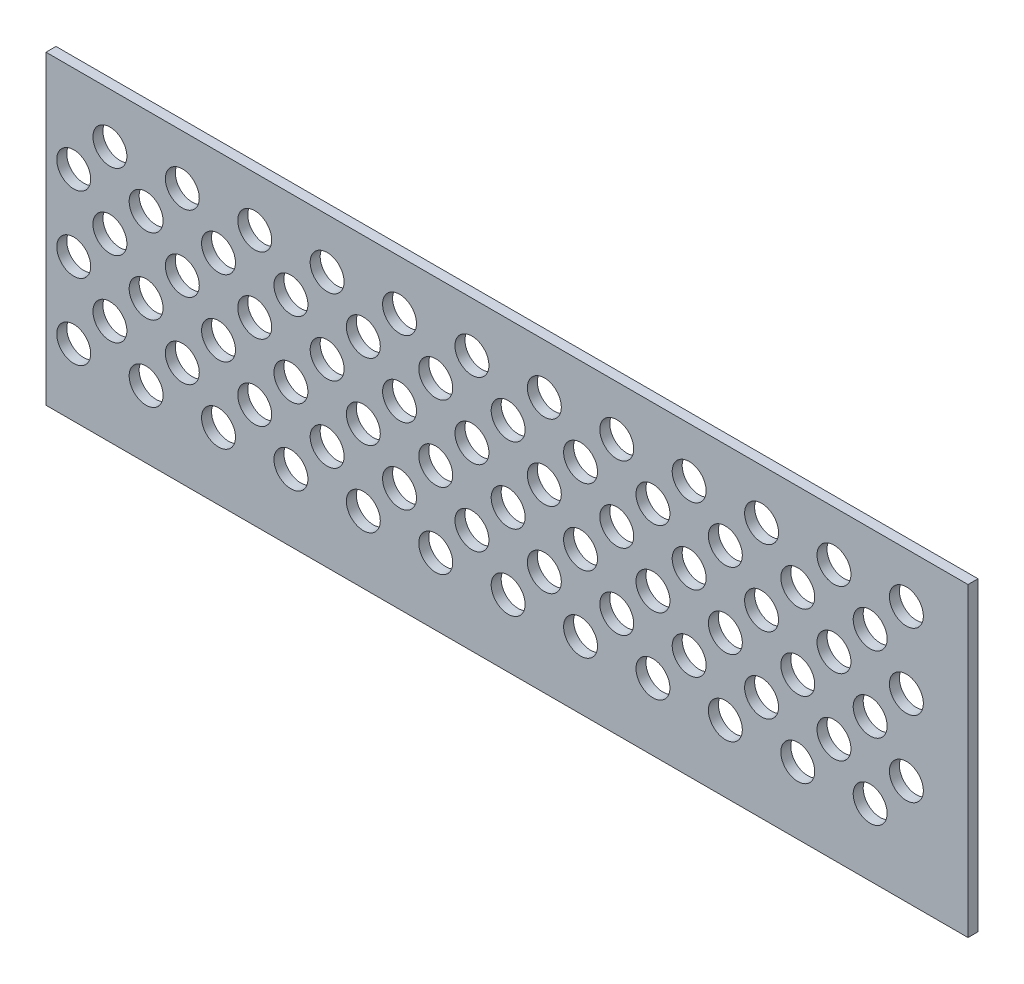
from build123d import *

# Parameters (mm, degrees)
SKETCH1_W                  = 585.750000132
SKETCH1_H                  = 194.250000104
BOSS_EXTRUDE1_DEPTH        = 6.35
SKETCH3_R                  = 10.775
CUT_EXTRUDE1_DEPTH         = 311.391443479
SKETCH4_R                  = 10.775
CUT_EXTRUDE2_DEPTH         = 311.391443479
LPATTERN1_COUNT            = 12
LPATTERN1_PITCH            = 46
LPATTERN2_COUNT            = 3
LPATTERN2_PITCH            = 48
LPATTERN2_COPY_1_SKETCH_R  = 10.775
LPATTERN2_COPY_1_DEPTH     = 311.391443479
LPATTERN2_COPY_2_SKETCH_R  = 10.775
LPATTERN2_COPY_2_DEPTH     = 311.391443479
LPATTERN2_COPY_3_SKETCH_R  = 10.775
LPATTERN2_COPY_3_DEPTH     = 311.391443479
LPATTERN2_COPY_4_SKETCH_R  = 10.775
LPATTERN2_COPY_4_DEPTH     = 311.391443479
LPATTERN2_COPY_5_SKETCH_R  = 10.775
LPATTERN2_COPY_5_DEPTH     = 311.391443479
LPATTERN2_COPY_6_SKETCH_R  = 10.775
LPATTERN2_COPY_6_DEPTH     = 311.391443479
LPATTERN2_COPY_7_SKETCH_R  = 10.775
LPATTERN2_COPY_7_DEPTH     = 311.391443479
LPATTERN2_COPY_8_SKETCH_R  = 10.775
LPATTERN2_COPY_8_DEPTH     = 311.391443479
LPATTERN2_COPY_9_SKETCH_R  = 10.775
LPATTERN2_COPY_9_DEPTH     = 311.391443479
LPATTERN2_COPY_10_SKETCH_R = 10.775
LPATTERN2_COPY_10_DEPTH    = 311.391443479
LPATTERN2_COPY_11_SKETCH_R = 10.775
LPATTERN2_COPY_11_DEPTH    = 311.391443479
LPATTERN2_COPY_12_SKETCH_R = 10.775
LPATTERN2_COPY_12_DEPTH    = 311.391443479
LPATTERN2_COPY_13_SKETCH_R = 10.775
LPATTERN2_COPY_13_DEPTH    = 311.391443479
LPATTERN2_COPY_14_SKETCH_R = 10.775
LPATTERN2_COPY_14_DEPTH    = 311.391443479
LPATTERN2_COPY_15_SKETCH_R = 10.775
LPATTERN2_COPY_15_DEPTH    = 311.391443479
LPATTERN2_COPY_16_SKETCH_R = 10.775
LPATTERN2_COPY_16_DEPTH    = 311.391443479
LPATTERN2_COPY_17_SKETCH_R = 10.775
LPATTERN2_COPY_17_DEPTH    = 311.391443479
LPATTERN2_COPY_18_SKETCH_R = 10.775
LPATTERN2_COPY_18_DEPTH    = 311.391443479
LPATTERN2_COPY_19_SKETCH_R = 10.775
LPATTERN2_COPY_19_DEPTH    = 311.391443479
LPATTERN2_COPY_20_SKETCH_R = 10.775
LPATTERN2_COPY_20_DEPTH    = 311.391443479
LPATTERN2_COPY_21_SKETCH_R = 10.775
LPATTERN2_COPY_21_DEPTH    = 311.391443479
LPATTERN2_COPY_22_SKETCH_R = 10.775
LPATTERN2_COPY_22_DEPTH    = 311.391443479
LPATTERN2_COPY_23_SKETCH_R = 10.775
LPATTERN2_COPY_23_DEPTH    = 311.391443479
LPATTERN2_COPY_24_SKETCH_R = 10.775
LPATTERN2_COPY_24_DEPTH    = 311.391443479
LPATTERN2_COPY_25_SKETCH_R = 10.775
LPATTERN2_COPY_25_DEPTH    = 311.391443479
LPATTERN2_COPY_26_SKETCH_R = 10.775
LPATTERN2_COPY_26_DEPTH    = 311.391443479
LPATTERN2_COPY_27_SKETCH_R = 10.775
LPATTERN2_COPY_27_DEPTH    = 311.391443479
LPATTERN2_COPY_28_SKETCH_R = 10.775
LPATTERN2_COPY_28_DEPTH    = 311.391443479
LPATTERN2_COPY_29_SKETCH_R = 10.775
LPATTERN2_COPY_29_DEPTH    = 311.391443479
LPATTERN2_COPY_30_SKETCH_R = 10.775
LPATTERN2_COPY_30_DEPTH    = 311.391443479
LPATTERN2_COPY_31_SKETCH_R = 10.775
LPATTERN2_COPY_31_DEPTH    = 311.391443479
LPATTERN2_COPY_32_SKETCH_R = 10.775
LPATTERN2_COPY_32_DEPTH    = 311.391443479
LPATTERN2_COPY_33_SKETCH_R = 10.775
LPATTERN2_COPY_33_DEPTH    = 311.391443479
LPATTERN2_COPY_34_SKETCH_R = 10.775
LPATTERN2_COPY_34_DEPTH    = 311.391443479
LPATTERN2_COPY_35_SKETCH_R = 10.775
LPATTERN2_COPY_35_DEPTH    = 311.391443479
LPATTERN2_COPY_36_SKETCH_R = 10.775
LPATTERN2_COPY_36_DEPTH    = 311.391443479
LPATTERN2_COPY_37_SKETCH_R = 10.775
LPATTERN2_COPY_37_DEPTH    = 311.391443479
LPATTERN2_COPY_38_SKETCH_R = 10.775
LPATTERN2_COPY_38_DEPTH    = 311.391443479
LPATTERN2_COPY_39_SKETCH_R = 10.775
LPATTERN2_COPY_39_DEPTH    = 311.391443479
LPATTERN2_COPY_40_SKETCH_R = 10.775
LPATTERN2_COPY_40_DEPTH    = 311.391443479
LPATTERN2_COPY_41_SKETCH_R = 10.775
LPATTERN2_COPY_41_DEPTH    = 311.391443479
LPATTERN2_COPY_42_SKETCH_R = 10.775
LPATTERN2_COPY_42_DEPTH    = 311.391443479
LPATTERN2_COPY_43_SKETCH_R = 10.775
LPATTERN2_COPY_43_DEPTH    = 311.391443479
LPATTERN2_COPY_44_SKETCH_R = 10.775
LPATTERN2_COPY_44_DEPTH    = 311.391443479


with BuildPart() as part:
    # Sketch1 → Boss-Extrude1 (new body)
    with BuildSketch(Plane.XY):
        with Locations((0, -5.475000052)):
            Rectangle(SKETCH1_W, SKETCH1_H)
    extrude(amount=BOSS_EXTRUDE1_DEPTH)

    # Sketch3 → Cut-Extrude1 (cut, through all)
    with BuildSketch(Plane.XY.offset(6.35)):
        with Locations((-275.275, -60)):
            Circle(SKETCH3_R)
    cut_extrude1 = extrude(amount=-CUT_EXTRUDE1_DEPTH, mode=Mode.SUBTRACT)

    # Sketch4 → Cut-Extrude2 (cut, through all)
    with BuildSketch(Plane.XY.offset(6.35)):
        with Locations((-252.275, -36)):
            Circle(SKETCH4_R)
    cut_extrude2 = extrude(amount=-CUT_EXTRUDE2_DEPTH, mode=Mode.SUBTRACT)

    # LPattern1: Cut-Extrude1, Cut-Extrude2 ×12
    with Locations(*[(i * LPATTERN1_PITCH, 0, 0) for i in range(1, LPATTERN1_COUNT)]):
        add(cut_extrude1, mode=Mode.SUBTRACT)
        add(cut_extrude2, mode=Mode.SUBTRACT)

    # LPattern2: Cut-Extrude1, Cut-Extrude2 ×3
    with Locations(*[(0, i * LPATTERN2_PITCH, 0) for i in range(1, LPATTERN2_COUNT)]):
        add(cut_extrude1, mode=Mode.SUBTRACT)
        add(cut_extrude2, mode=Mode.SUBTRACT)

    # LPattern2 copy 1 sketch → LPattern2 copy 1 (cut, through all)
    with BuildSketch(Plane(origin=(46, 48, 6.35), x_dir=(1, 0, 0), z_dir=(0, 0, 1))):
        with Locations((-275.275, -60)):
            Circle(LPATTERN2_COPY_1_SKETCH_R)
    extrude(amount=-LPATTERN2_COPY_1_DEPTH, mode=Mode.SUBTRACT)

    # LPattern2 copy 2 sketch → LPattern2 copy 2 (cut, through all)
    with BuildSketch(Plane(origin=(46, 96, 6.35), x_dir=(1, 0, 0), z_dir=(0, 0, 1))):
        with Locations((-275.275, -60)):
            Circle(LPATTERN2_COPY_2_SKETCH_R)
    extrude(amount=-LPATTERN2_COPY_2_DEPTH, mode=Mode.SUBTRACT)

    # LPattern2 copy 3 sketch → LPattern2 copy 3 (cut, through all)
    with BuildSketch(Plane(origin=(92, 48, 6.35), x_dir=(1, 0, 0), z_dir=(0, 0, 1))):
        with Locations((-275.275, -60)):
            Circle(LPATTERN2_COPY_3_SKETCH_R)
    extrude(amount=-LPATTERN2_COPY_3_DEPTH, mode=Mode.SUBTRACT)

    # LPattern2 copy 4 sketch → LPattern2 copy 4 (cut, through all)
    with BuildSketch(Plane(origin=(92, 96, 6.35), x_dir=(1, 0, 0), z_dir=(0, 0, 1))):
        with Locations((-275.275, -60)):
            Circle(LPATTERN2_COPY_4_SKETCH_R)
    extrude(amount=-LPATTERN2_COPY_4_DEPTH, mode=Mode.SUBTRACT)

    # LPattern2 copy 5 sketch → LPattern2 copy 5 (cut, through all)
    with BuildSketch(Plane(origin=(138, 48, 6.35), x_dir=(1, 0, 0), z_dir=(0, 0, 1))):
        with Locations((-275.275, -60)):
            Circle(LPATTERN2_COPY_5_SKETCH_R)
    extrude(amount=-LPATTERN2_COPY_5_DEPTH, mode=Mode.SUBTRACT)

    # LPattern2 copy 6 sketch → LPattern2 copy 6 (cut, through all)
    with BuildSketch(Plane(origin=(138, 96, 6.35), x_dir=(1, 0, 0), z_dir=(0, 0, 1))):
        with Locations((-275.275, -60)):
            Circle(LPATTERN2_COPY_6_SKETCH_R)
    extrude(amount=-LPATTERN2_COPY_6_DEPTH, mode=Mode.SUBTRACT)

    # LPattern2 copy 7 sketch → LPattern2 copy 7 (cut, through all)
    with BuildSketch(Plane(origin=(184, 48, 6.35), x_dir=(1, 0, 0), z_dir=(0, 0, 1))):
        with Locations((-275.275, -60)):
            Circle(LPATTERN2_COPY_7_SKETCH_R)
    extrude(amount=-LPATTERN2_COPY_7_DEPTH, mode=Mode.SUBTRACT)

    # LPattern2 copy 8 sketch → LPattern2 copy 8 (cut, through all)
    with BuildSketch(Plane(origin=(184, 96, 6.35), x_dir=(1, 0, 0), z_dir=(0, 0, 1))):
        with Locations((-275.275, -60)):
            Circle(LPATTERN2_COPY_8_SKETCH_R)
    extrude(amount=-LPATTERN2_COPY_8_DEPTH, mode=Mode.SUBTRACT)

    # LPattern2 copy 9 sketch → LPattern2 copy 9 (cut, through all)
    with BuildSketch(Plane(origin=(230, 48, 6.35), x_dir=(1, 0, 0), z_dir=(0, 0, 1))):
        with Locations((-275.275, -60)):
            Circle(LPATTERN2_COPY_9_SKETCH_R)
    extrude(amount=-LPATTERN2_COPY_9_DEPTH, mode=Mode.SUBTRACT)

    # LPattern2 copy 10 sketch → LPattern2 copy 10 (cut, through all)
    with BuildSketch(Plane(origin=(230, 96, 6.35), x_dir=(1, 0, 0), z_dir=(0, 0, 1))):
        with Locations((-275.275, -60)):
            Circle(LPATTERN2_COPY_10_SKETCH_R)
    extrude(amount=-LPATTERN2_COPY_10_DEPTH, mode=Mode.SUBTRACT)

    # LPattern2 copy 11 sketch → LPattern2 copy 11 (cut, through all)
    with BuildSketch(Plane(origin=(276, 48, 6.35), x_dir=(1, 0, 0), z_dir=(0, 0, 1))):
        with Locations((-275.275, -60)):
            Circle(LPATTERN2_COPY_11_SKETCH_R)
    extrude(amount=-LPATTERN2_COPY_11_DEPTH, mode=Mode.SUBTRACT)

    # LPattern2 copy 12 sketch → LPattern2 copy 12 (cut, through all)
    with BuildSketch(Plane(origin=(276, 96, 6.35), x_dir=(1, 0, 0), z_dir=(0, 0, 1))):
        with Locations((-275.275, -60)):
            Circle(LPATTERN2_COPY_12_SKETCH_R)
    extrude(amount=-LPATTERN2_COPY_12_DEPTH, mode=Mode.SUBTRACT)

    # LPattern2 copy 13 sketch → LPattern2 copy 13 (cut, through all)
    with BuildSketch(Plane(origin=(322, 48, 6.35), x_dir=(1, 0, 0), z_dir=(0, 0, 1))):
        with Locations((-275.275, -60)):
            Circle(LPATTERN2_COPY_13_SKETCH_R)
    extrude(amount=-LPATTERN2_COPY_13_DEPTH, mode=Mode.SUBTRACT)

    # LPattern2 copy 14 sketch → LPattern2 copy 14 (cut, through all)
    with BuildSketch(Plane(origin=(322, 96, 6.35), x_dir=(1, 0, 0), z_dir=(0, 0, 1))):
        with Locations((-275.275, -60)):
            Circle(LPATTERN2_COPY_14_SKETCH_R)
    extrude(amount=-LPATTERN2_COPY_14_DEPTH, mode=Mode.SUBTRACT)

    # LPattern2 copy 15 sketch → LPattern2 copy 15 (cut, through all)
    with BuildSketch(Plane(origin=(368, 48, 6.35), x_dir=(1, 0, 0), z_dir=(0, 0, 1))):
        with Locations((-275.275, -60)):
            Circle(LPATTERN2_COPY_15_SKETCH_R)
    extrude(amount=-LPATTERN2_COPY_15_DEPTH, mode=Mode.SUBTRACT)

    # LPattern2 copy 16 sketch → LPattern2 copy 16 (cut, through all)
    with BuildSketch(Plane(origin=(368, 96, 6.35), x_dir=(1, 0, 0), z_dir=(0, 0, 1))):
        with Locations((-275.275, -60)):
            Circle(LPATTERN2_COPY_16_SKETCH_R)
    extrude(amount=-LPATTERN2_COPY_16_DEPTH, mode=Mode.SUBTRACT)

    # LPattern2 copy 17 sketch → LPattern2 copy 17 (cut, through all)
    with BuildSketch(Plane(origin=(414, 48, 6.35), x_dir=(1, 0, 0), z_dir=(0, 0, 1))):
        with Locations((-275.275, -60)):
            Circle(LPATTERN2_COPY_17_SKETCH_R)
    extrude(amount=-LPATTERN2_COPY_17_DEPTH, mode=Mode.SUBTRACT)

    # LPattern2 copy 18 sketch → LPattern2 copy 18 (cut, through all)
    with BuildSketch(Plane(origin=(414, 96, 6.35), x_dir=(1, 0, 0), z_dir=(0, 0, 1))):
        with Locations((-275.275, -60)):
            Circle(LPATTERN2_COPY_18_SKETCH_R)
    extrude(amount=-LPATTERN2_COPY_18_DEPTH, mode=Mode.SUBTRACT)

    # LPattern2 copy 19 sketch → LPattern2 copy 19 (cut, through all)
    with BuildSketch(Plane(origin=(460, 48, 6.35), x_dir=(1, 0, 0), z_dir=(0, 0, 1))):
        with Locations((-275.275, -60)):
            Circle(LPATTERN2_COPY_19_SKETCH_R)
    extrude(amount=-LPATTERN2_COPY_19_DEPTH, mode=Mode.SUBTRACT)

    # LPattern2 copy 20 sketch → LPattern2 copy 20 (cut, through all)
    with BuildSketch(Plane(origin=(460, 96, 6.35), x_dir=(1, 0, 0), z_dir=(0, 0, 1))):
        with Locations((-275.275, -60)):
            Circle(LPATTERN2_COPY_20_SKETCH_R)
    extrude(amount=-LPATTERN2_COPY_20_DEPTH, mode=Mode.SUBTRACT)

    # LPattern2 copy 21 sketch → LPattern2 copy 21 (cut, through all)
    with BuildSketch(Plane(origin=(506, 48, 6.35), x_dir=(1, 0, 0), z_dir=(0, 0, 1))):
        with Locations((-275.275, -60)):
            Circle(LPATTERN2_COPY_21_SKETCH_R)
    extrude(amount=-LPATTERN2_COPY_21_DEPTH, mode=Mode.SUBTRACT)

    # LPattern2 copy 22 sketch → LPattern2 copy 22 (cut, through all)
    with BuildSketch(Plane(origin=(506, 96, 6.35), x_dir=(1, 0, 0), z_dir=(0, 0, 1))):
        with Locations((-275.275, -60)):
            Circle(LPATTERN2_COPY_22_SKETCH_R)
    extrude(amount=-LPATTERN2_COPY_22_DEPTH, mode=Mode.SUBTRACT)

    # LPattern2 copy 23 sketch → LPattern2 copy 23 (cut, through all)
    with BuildSketch(Plane(origin=(46, 48, 6.35), x_dir=(1, 0, 0), z_dir=(0, 0, 1))):
        with Locations((-252.275, -36)):
            Circle(LPATTERN2_COPY_23_SKETCH_R)
    extrude(amount=-LPATTERN2_COPY_23_DEPTH, mode=Mode.SUBTRACT)

    # LPattern2 copy 24 sketch → LPattern2 copy 24 (cut, through all)
    with BuildSketch(Plane(origin=(46, 96, 6.35), x_dir=(1, 0, 0), z_dir=(0, 0, 1))):
        with Locations((-252.275, -36)):
            Circle(LPATTERN2_COPY_24_SKETCH_R)
    extrude(amount=-LPATTERN2_COPY_24_DEPTH, mode=Mode.SUBTRACT)

    # LPattern2 copy 25 sketch → LPattern2 copy 25 (cut, through all)
    with BuildSketch(Plane(origin=(92, 48, 6.35), x_dir=(1, 0, 0), z_dir=(0, 0, 1))):
        with Locations((-252.275, -36)):
            Circle(LPATTERN2_COPY_25_SKETCH_R)
    extrude(amount=-LPATTERN2_COPY_25_DEPTH, mode=Mode.SUBTRACT)

    # LPattern2 copy 26 sketch → LPattern2 copy 26 (cut, through all)
    with BuildSketch(Plane(origin=(92, 96, 6.35), x_dir=(1, 0, 0), z_dir=(0, 0, 1))):
        with Locations((-252.275, -36)):
            Circle(LPATTERN2_COPY_26_SKETCH_R)
    extrude(amount=-LPATTERN2_COPY_26_DEPTH, mode=Mode.SUBTRACT)

    # LPattern2 copy 27 sketch → LPattern2 copy 27 (cut, through all)
    with BuildSketch(Plane(origin=(138, 48, 6.35), x_dir=(1, 0, 0), z_dir=(0, 0, 1))):
        with Locations((-252.275, -36)):
            Circle(LPATTERN2_COPY_27_SKETCH_R)
    extrude(amount=-LPATTERN2_COPY_27_DEPTH, mode=Mode.SUBTRACT)

    # LPattern2 copy 28 sketch → LPattern2 copy 28 (cut, through all)
    with BuildSketch(Plane(origin=(138, 96, 6.35), x_dir=(1, 0, 0), z_dir=(0, 0, 1))):
        with Locations((-252.275, -36)):
            Circle(LPATTERN2_COPY_28_SKETCH_R)
    extrude(amount=-LPATTERN2_COPY_28_DEPTH, mode=Mode.SUBTRACT)

    # LPattern2 copy 29 sketch → LPattern2 copy 29 (cut, through all)
    with BuildSketch(Plane(origin=(184, 48, 6.35), x_dir=(1, 0, 0), z_dir=(0, 0, 1))):
        with Locations((-252.275, -36)):
            Circle(LPATTERN2_COPY_29_SKETCH_R)
    extrude(amount=-LPATTERN2_COPY_29_DEPTH, mode=Mode.SUBTRACT)

    # LPattern2 copy 30 sketch → LPattern2 copy 30 (cut, through all)
    with BuildSketch(Plane(origin=(184, 96, 6.35), x_dir=(1, 0, 0), z_dir=(0, 0, 1))):
        with Locations((-252.275, -36)):
            Circle(LPATTERN2_COPY_30_SKETCH_R)
    extrude(amount=-LPATTERN2_COPY_30_DEPTH, mode=Mode.SUBTRACT)

    # LPattern2 copy 31 sketch → LPattern2 copy 31 (cut, through all)
    with BuildSketch(Plane(origin=(230, 48, 6.35), x_dir=(1, 0, 0), z_dir=(0, 0, 1))):
        with Locations((-252.275, -36)):
            Circle(LPATTERN2_COPY_31_SKETCH_R)
    extrude(amount=-LPATTERN2_COPY_31_DEPTH, mode=Mode.SUBTRACT)

    # LPattern2 copy 32 sketch → LPattern2 copy 32 (cut, through all)
    with BuildSketch(Plane(origin=(230, 96, 6.35), x_dir=(1, 0, 0), z_dir=(0, 0, 1))):
        with Locations((-252.275, -36)):
            Circle(LPATTERN2_COPY_32_SKETCH_R)
    extrude(amount=-LPATTERN2_COPY_32_DEPTH, mode=Mode.SUBTRACT)

    # LPattern2 copy 33 sketch → LPattern2 copy 33 (cut, through all)
    with BuildSketch(Plane(origin=(276, 48, 6.35), x_dir=(1, 0, 0), z_dir=(0, 0, 1))):
        with Locations((-252.275, -36)):
            Circle(LPATTERN2_COPY_33_SKETCH_R)
    extrude(amount=-LPATTERN2_COPY_33_DEPTH, mode=Mode.SUBTRACT)

    # LPattern2 copy 34 sketch → LPattern2 copy 34 (cut, through all)
    with BuildSketch(Plane(origin=(276, 96, 6.35), x_dir=(1, 0, 0), z_dir=(0, 0, 1))):
        with Locations((-252.275, -36)):
            Circle(LPATTERN2_COPY_34_SKETCH_R)
    extrude(amount=-LPATTERN2_COPY_34_DEPTH, mode=Mode.SUBTRACT)

    # LPattern2 copy 35 sketch → LPattern2 copy 35 (cut, through all)
    with BuildSketch(Plane(origin=(322, 48, 6.35), x_dir=(1, 0, 0), z_dir=(0, 0, 1))):
        with Locations((-252.275, -36)):
            Circle(LPATTERN2_COPY_35_SKETCH_R)
    extrude(amount=-LPATTERN2_COPY_35_DEPTH, mode=Mode.SUBTRACT)

    # LPattern2 copy 36 sketch → LPattern2 copy 36 (cut, through all)
    with BuildSketch(Plane(origin=(322, 96, 6.35), x_dir=(1, 0, 0), z_dir=(0, 0, 1))):
        with Locations((-252.275, -36)):
            Circle(LPATTERN2_COPY_36_SKETCH_R)
    extrude(amount=-LPATTERN2_COPY_36_DEPTH, mode=Mode.SUBTRACT)

    # LPattern2 copy 37 sketch → LPattern2 copy 37 (cut, through all)
    with BuildSketch(Plane(origin=(368, 48, 6.35), x_dir=(1, 0, 0), z_dir=(0, 0, 1))):
        with Locations((-252.275, -36)):
            Circle(LPATTERN2_COPY_37_SKETCH_R)
    extrude(amount=-LPATTERN2_COPY_37_DEPTH, mode=Mode.SUBTRACT)

    # LPattern2 copy 38 sketch → LPattern2 copy 38 (cut, through all)
    with BuildSketch(Plane(origin=(368, 96, 6.35), x_dir=(1, 0, 0), z_dir=(0, 0, 1))):
        with Locations((-252.275, -36)):
            Circle(LPATTERN2_COPY_38_SKETCH_R)
    extrude(amount=-LPATTERN2_COPY_38_DEPTH, mode=Mode.SUBTRACT)

    # LPattern2 copy 39 sketch → LPattern2 copy 39 (cut, through all)
    with BuildSketch(Plane(origin=(414, 48, 6.35), x_dir=(1, 0, 0), z_dir=(0, 0, 1))):
        with Locations((-252.275, -36)):
            Circle(LPATTERN2_COPY_39_SKETCH_R)
    extrude(amount=-LPATTERN2_COPY_39_DEPTH, mode=Mode.SUBTRACT)

    # LPattern2 copy 40 sketch → LPattern2 copy 40 (cut, through all)
    with BuildSketch(Plane(origin=(414, 96, 6.35), x_dir=(1, 0, 0), z_dir=(0, 0, 1))):
        with Locations((-252.275, -36)):
            Circle(LPATTERN2_COPY_40_SKETCH_R)
    extrude(amount=-LPATTERN2_COPY_40_DEPTH, mode=Mode.SUBTRACT)

    # LPattern2 copy 41 sketch → LPattern2 copy 41 (cut, through all)
    with BuildSketch(Plane(origin=(460, 48, 6.35), x_dir=(1, 0, 0), z_dir=(0, 0, 1))):
        with Locations((-252.275, -36)):
            Circle(LPATTERN2_COPY_41_SKETCH_R)
    extrude(amount=-LPATTERN2_COPY_41_DEPTH, mode=Mode.SUBTRACT)

    # LPattern2 copy 42 sketch → LPattern2 copy 42 (cut, through all)
    with BuildSketch(Plane(origin=(460, 96, 6.35), x_dir=(1, 0, 0), z_dir=(0, 0, 1))):
        with Locations((-252.275, -36)):
            Circle(LPATTERN2_COPY_42_SKETCH_R)
    extrude(amount=-LPATTERN2_COPY_42_DEPTH, mode=Mode.SUBTRACT)

    # LPattern2 copy 43 sketch → LPattern2 copy 43 (cut, through all)
    with BuildSketch(Plane(origin=(506, 48, 6.35), x_dir=(1, 0, 0), z_dir=(0, 0, 1))):
        with Locations((-252.275, -36)):
            Circle(LPATTERN2_COPY_43_SKETCH_R)
    extrude(amount=-LPATTERN2_COPY_43_DEPTH, mode=Mode.SUBTRACT)

    # LPattern2 copy 44 sketch → LPattern2 copy 44 (cut, through all)
    with BuildSketch(Plane(origin=(506, 96, 6.35), x_dir=(1, 0, 0), z_dir=(0, 0, 1))):
        with Locations((-252.275, -36)):
            Circle(LPATTERN2_COPY_44_SKETCH_R)
    extrude(amount=-LPATTERN2_COPY_44_DEPTH, mode=Mode.SUBTRACT)


solid = part.part
